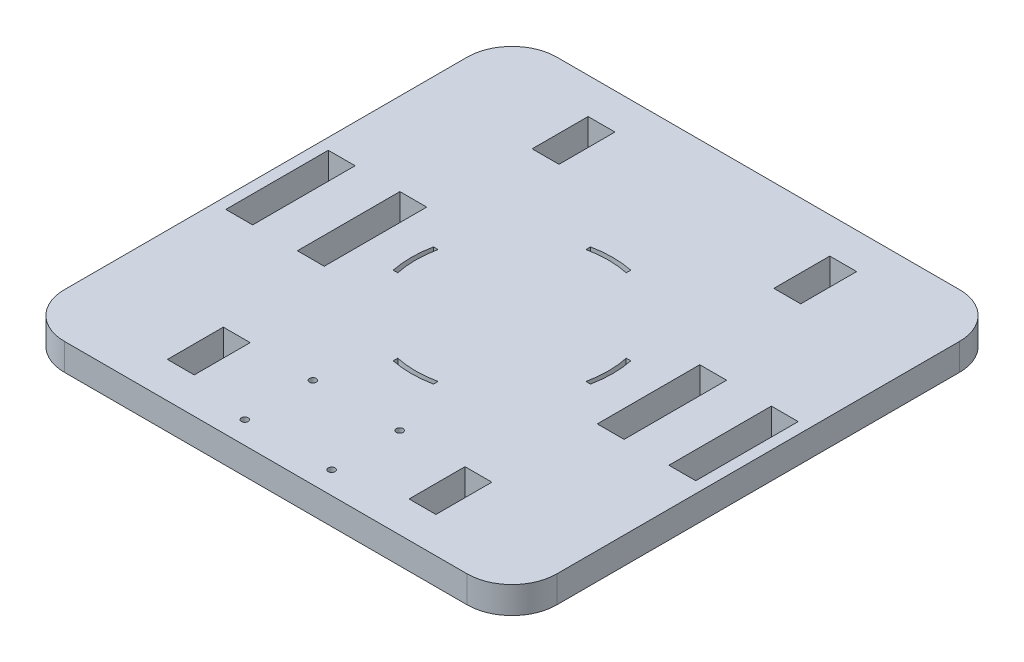
from build123d import *

# Parameters (mm, degrees)
SKETCH1_W           = 279.4
SKETCH1_H           = 279.4
BOSS_EXTRUDE1_DEPTH = 15.24
FILLET1_R           = 25.4
SKETCH2_W           = 15.24
SKETCH2_H           = 31.75
CUT_EXTRUDE1_DEPTH  = 396.425059398
SKETCH3_W           = 15.24
SKETCH3_H           = 58.166
CUT_EXTRUDE2_DEPTH  = 396.425059398
SKETCH5_R           = 1.905
CUT_EXTRUDE4_DEPTH  = 396.425059398
CUT_EXTRUDE5_DEPTH  = 396.425059398


with BuildPart() as part:
    # Sketch1 → Boss-Extrude1 (new body)
    with BuildSketch(Plane(origin=(0, 0, 0), x_dir=(1, 0, 0), z_dir=(0, 1, 0))):
        with Locations((139.7, 139.7)):
            Rectangle(SKETCH1_W, SKETCH1_H)
    extrude(amount=BOSS_EXTRUDE1_DEPTH)

    # Fillet1
    fillet1_edges = [part.edges().sort_by_distance(p)[0] for p in [
        (0, 7.62, -279.4),
        (279.4, 7.62, -279.4),
        (279.4, 7.62, 0),
        (0, 7.62, 0),
    ]]
    fillet(fillet1_edges, radius=FILLET1_R)

    # Sketch2 → Cut-Extrude1 (cut, through all)
    with BuildSketch(Plane(origin=(0, 15.24, 0), x_dir=(1, 0, 0), z_dir=(0, 1, 0))):
        with Locations((71.12, 243.205)):
            Rectangle(SKETCH2_W, SKETCH2_H)
        with Locations((208.28, 243.205)):
            Rectangle(SKETCH2_W, SKETCH2_H)
        with Locations((71.12, 36.195)):
            Rectangle(SKETCH2_W, SKETCH2_H)
        with Locations((208.28, 36.195)):
            Rectangle(SKETCH2_W, SKETCH2_H)
    extrude(amount=-CUT_EXTRUDE1_DEPTH, mode=Mode.SUBTRACT)

    # Sketch3 → Cut-Extrude2 (cut, through all)
    with BuildSketch(Plane(origin=(0, 15.24, 0), x_dir=(1, 0, 0), z_dir=(0, 1, 0))):
        with Locations((13.97, 139.7)):
            Rectangle(SKETCH3_W, SKETCH3_H)
        with Locations((265.43, 139.7)):
            Rectangle(SKETCH3_W, SKETCH3_H)
        with Locations((54.61, 139.7)):
            Rectangle(SKETCH3_W, SKETCH3_H)
        with Locations((224.79, 139.7)):
            Rectangle(SKETCH3_W, SKETCH3_H)
    extrude(amount=-CUT_EXTRUDE2_DEPTH, mode=Mode.SUBTRACT)

    # Sketch5 → Cut-Extrude4 (cut, through all)
    with BuildSketch(Plane.XZ):
        with Locations(Location((115.062, -12.7, 0), (0, 0, 270))):
            Circle(SKETCH5_R)
        with Locations(Location((164.338, -12.7, 0), (0, 0, 270))):
            Circle(SKETCH5_R)
        with Locations(Location((164.338, -51.308, 0), (0, 0, 270))):
            Circle(SKETCH5_R)
        with Locations(Location((115.062, -51.308, 0), (0, 0, 270))):
            Circle(SKETCH5_R)
    extrude(amount=-CUT_EXTRUDE4_DEPTH, mode=Mode.SUBTRACT)

    # Sketch6 → Cut-Extrude5 (cut, through all)
    with BuildSketch(Plane(origin=(0, 15.24, 0), x_dir=(1, 0, 0), z_dir=(0, 1, 0))):
        with BuildLine():
            Line((83.70466448, 128.27), (86.299558054, 128.27))
            ThreePointArc((86.299558054, 128.27), (85.09, 139.7), (86.299558054, 151.13))
            Line((86.299558054, 151.13), (83.70466448, 151.13))
            ThreePointArc((83.70466448, 151.13), (82.55, 139.7), (83.70466448, 128.27))
        make_face()
        with BuildLine():
            Line((128.27, 193.100441946), (128.27, 195.69533552))
            ThreePointArc((128.27, 195.69533552), (139.7, 196.85), (151.13, 195.69533552))
            Line((151.13, 195.69533552), (151.13, 193.100441946))
            ThreePointArc((151.13, 193.100441946), (139.7, 194.31), (128.27, 193.100441946))
        make_face()
        with BuildLine():
            Line((193.100441946, 128.27), (195.69533552, 128.27))
            ThreePointArc((195.69533552, 128.27), (196.85, 139.7), (195.69533552, 151.13))
            Line((195.69533552, 151.13), (193.100441946, 151.13))
            ThreePointArc((193.100441946, 151.13), (194.31, 139.7), (193.100441946, 128.27))
        make_face()
        with BuildLine():
            Line((151.13, 86.299558054), (151.13, 83.70466448))
            ThreePointArc((151.13, 83.70466448), (139.7, 82.55), (128.27, 83.70466448))
            Line((128.27, 83.70466448), (128.27, 86.299558054))
            ThreePointArc((128.27, 86.299558054), (139.7, 85.09), (151.13, 86.299558054))
        make_face()
    extrude(amount=-CUT_EXTRUDE5_DEPTH, mode=Mode.SUBTRACT)


solid = part.part
